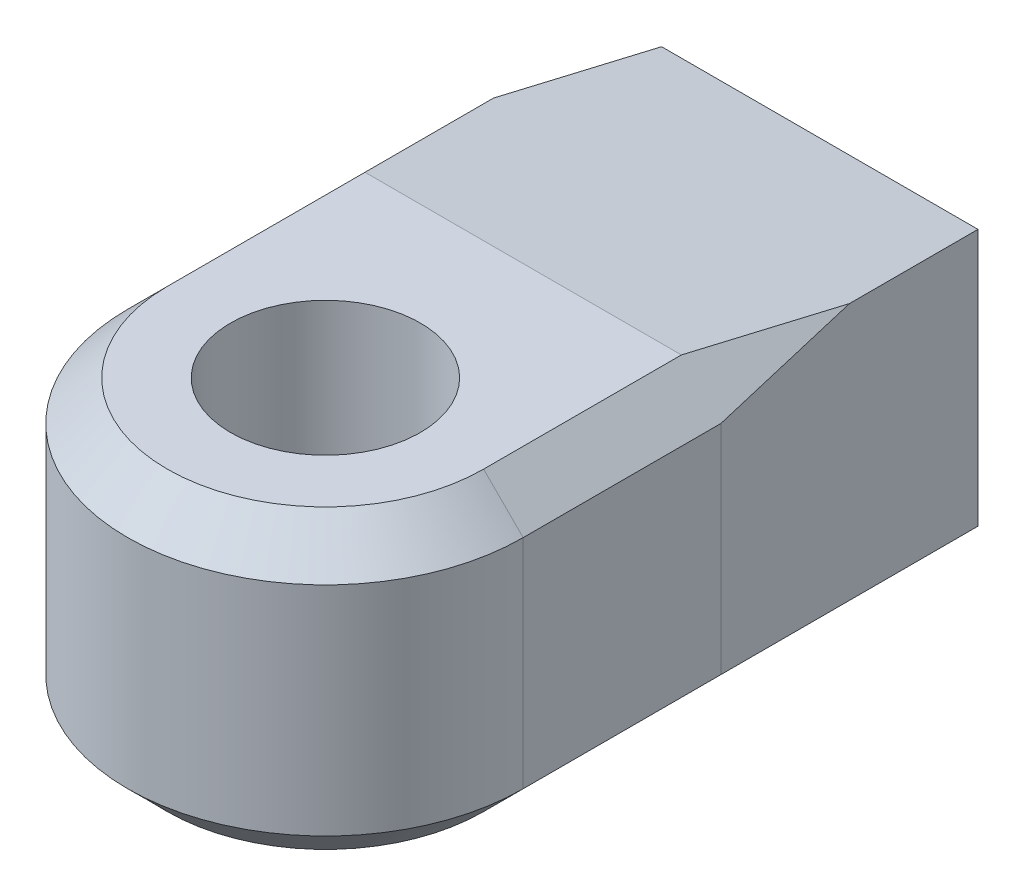
from build123d import *
from OCP.BRepFilletAPI import BRepFilletAPI_MakeChamfer

# Parameters (mm, degrees)
BOSS_EXTRUDE1_DEPTH = 15
CHAMFER1_SIZE       = 15
CHAMFER1_SIZE2      = 2
SKETCH2_R           = 3
CUT_EXTRUDE1_DEPTH  = 15
CHAMFER2_SIZE       = 2


with BuildPart() as part:
    # Sketch1 → Boss-Extrude1 (new body)
    with BuildSketch(Plane(origin=(0, 0, 0), x_dir=(1, 0, 0), z_dir=(0, 1, 0))):
        with BuildLine():
            ThreePointArc((-10, 0), (0, 10), (10, 0))
            Line((10, 0), (10, 25))
            Line((10, 25), (-10, 25))
            Line((-10, 25), (-10, 0))
        make_face()
        with BuildLine():
            ThreePointArc((-4.8, 0), (0, 4.8), (4.8, 0))
            Line((4.8, 0), (10, 0))
            ThreePointArc((10, 0), (0, 10), (-10, 0))
            Line((-10, 0), (-4.8, 0))
        make_face()
        with BuildLine():
            Line((10, 0), (4.8, 0))
            ThreePointArc((4.8, 0), (0, -4.8), (-4.8, 0))
            Line((-4.8, 0), (-10, 0))
            ThreePointArc((-10, 0), (0, -10), (10, 0))
        make_face()
    extrude(amount=BOSS_EXTRUDE1_DEPTH)

    # Chamfer1: one chamfer whose edges measure the first distance from different faces: ONE call of the kernel's chamfer builder (chamfer() names one face for all edges)
    chamfer1_edges_1 = [part.edges().sort_by_distance(p)[0] for p in [
        (-10, 7.5, -25),
    ]]
    chamfer1_side_1 = [part.faces().sort_by_distance(p)[0] for p in [
        (-10, 7.5, -12.5),
    ]]
    chamfer1_edges_2 = [part.edges().sort_by_distance(p)[0] for p in [
        (10, 7.5, -25),
    ]]
    chamfer1_side_2 = [part.faces().sort_by_distance(p)[0] for p in [
        (10, 7.5, -12.5),
    ]]
    chamfer1_edges_3 = [part.edges().sort_by_distance(p)[0] for p in [
        (0, 15, -25),
    ]]
    chamfer1_side_3 = [part.faces().sort_by_distance(p)[0] for p in [
        (0, 15, -9.549099972),
    ]]
    chamfer1 = BRepFilletAPI_MakeChamfer(part.part.solid().wrapped)
    for e in chamfer1_edges_1:
        chamfer1.Add(CHAMFER1_SIZE, CHAMFER1_SIZE2, e.wrapped, chamfer1_side_1[0].wrapped)  # the first distance lies on this face
    for e in chamfer1_edges_2:
        chamfer1.Add(CHAMFER1_SIZE, CHAMFER1_SIZE2, e.wrapped, chamfer1_side_2[0].wrapped)  # the first distance lies on this face
    for e in chamfer1_edges_3:
        chamfer1.Add(CHAMFER1_SIZE, CHAMFER1_SIZE2, e.wrapped, chamfer1_side_3[0].wrapped)  # the first distance lies on this face
    add(Compound.cast(chamfer1.Shape()), mode=Mode.REPLACE)

    # Sketch2 → Cut-Extrude1 (cut)
    with BuildSketch(Plane(origin=(0, 0, -25), x_dir=(-1, 0, 0), z_dir=(0, 0, -1))):
        with Locations((0, 7.2)):
            Circle(SKETCH2_R)
    extrude(amount=-CUT_EXTRUDE1_DEPTH, mode=Mode.SUBTRACT)

    # Chamfer2
    chamfer2_edges = [part.edges().sort_by_distance(p)[0] for p in [
        (0, 0, 10),
        (0, 15, 10),
        (-10, 15, -5),
        (-10, 0, -5),
        (10, 0, -5),
        (10, 15, -5),
    ]]
    chamfer(chamfer2_edges, length=CHAMFER2_SIZE)


solid = part.part
